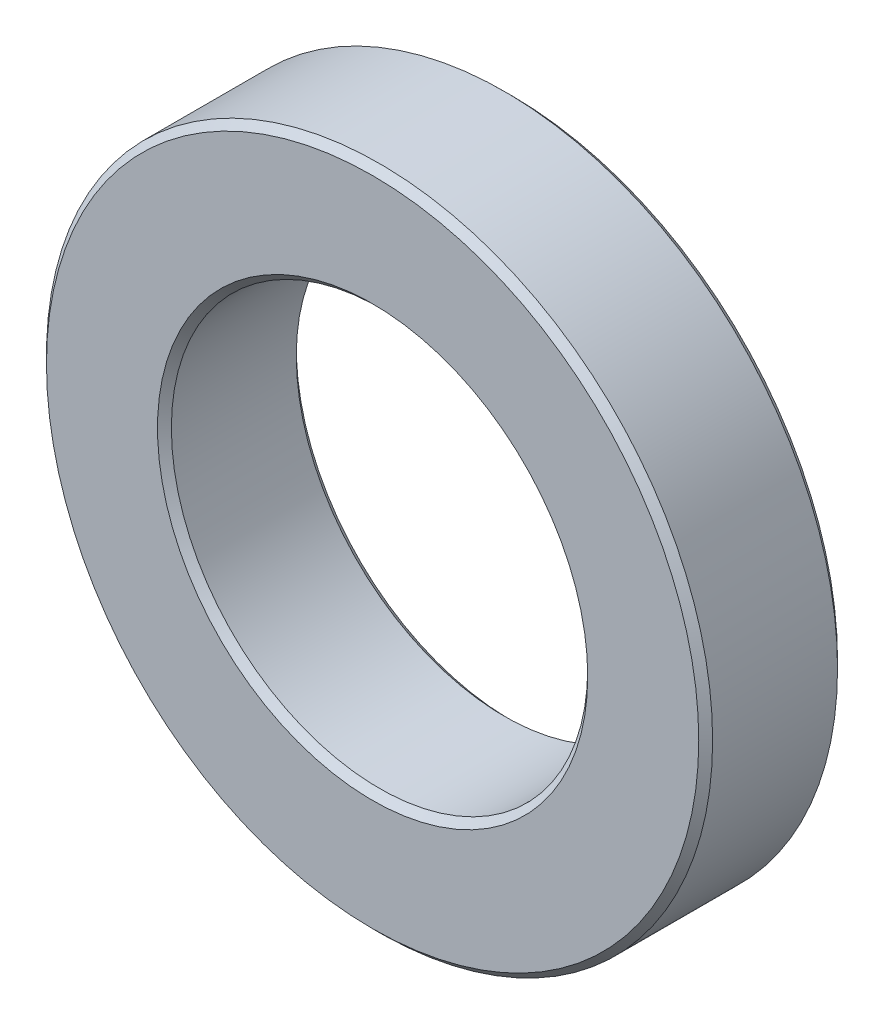
from build123d import *

# Parameters (mm, degrees)
SKETCH_1_R      = 12
SKETCH_1_R_2    = 7.5
EXTRUDE_1_DEPTH = 5
CHAMFER_5_SIZE  = 0.25


with BuildPart() as part:
    # Эскиз1 → Бобышка-Вытянуть1 (new body)
    with BuildSketch(Plane.XY):
        Circle(SKETCH_1_R)
        Circle(SKETCH_1_R_2, mode=Mode.SUBTRACT)
    extrude(amount=EXTRUDE_1_DEPTH)

    # Фаска5
    chamfer_5_edges = [part.edges().sort_by_distance(p)[0] for p in [
        (-12, 0, 0),
        (-12, 0, 5),
        (-7.5, 0, 0),
        (-7.5, 0, 5),
    ]]
    chamfer(chamfer_5_edges, length=CHAMFER_5_SIZE)


solid = part.part
